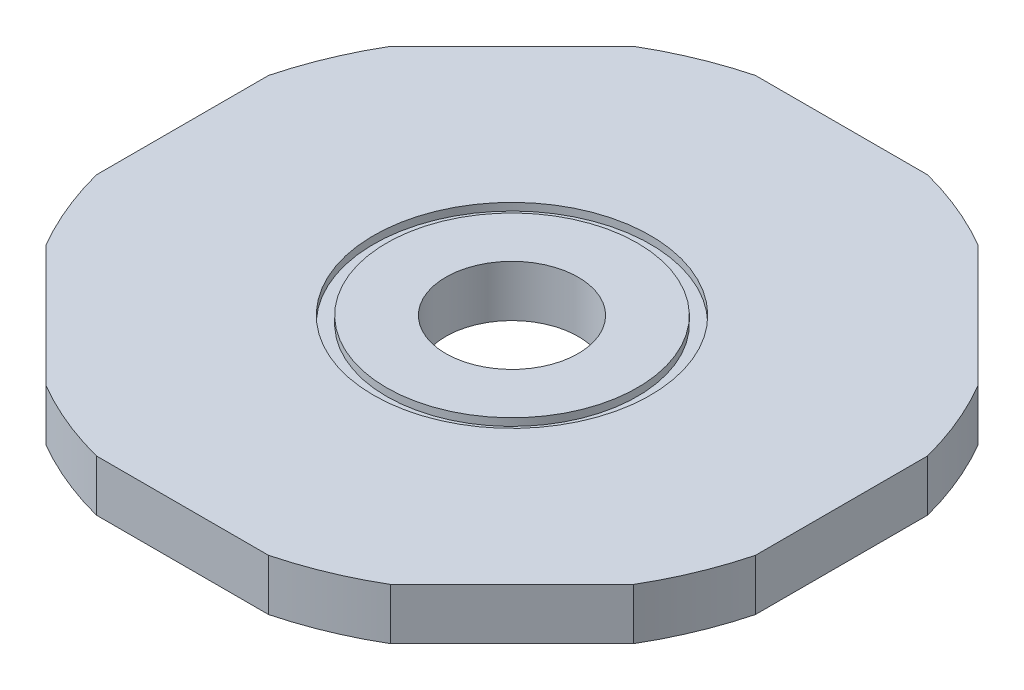
from build123d import *

# Parameters (mm, degrees)
BOSS_EXTRUDE1_DEPTH         = 19.05
SKETCH3_R                   = 24.5745
CUT_EXTRUDE1_DEPTH          = 175.004260005
SKETCH5_R                   = 51.3715
SKETCH5_R_2                 = 46.5455
CUT_EXTRUDE2_DEPTH          = 2.794
SKETCH7_R                   = 4
CUT_EXTRUDE3_DEPTH          = 12.7
M8_TAPPED_HOLE1_D           = 6.8
M8_TAPPED_HOLE1_DEPTH       = 13.957067295
M8_TAPPED_HOLE1_CSINK_D     = 8.05
M8_TAPPED_HOLE1_CSINK_ANGLE = 90
M8_TAPPED_HOLE1_TIP         = 2.042926105
CIRPATTERN1_COUNT           = 8


with BuildPart() as part:
    # Sketch1 → Boss-Extrude1 (new body)
    with BuildSketch(Plane(origin=(0, 0, 0), x_dir=(1, 0, 0), z_dir=(0, 1, 0))):
        with BuildLine():
            ThreePointArc((-31.932272077, 122.3), (-48.371185851, 116.778372909), (-63.899633215, 109.058685463))
            Line((-63.899633215, 109.058685463), (-109.058685463, 63.899633215))
            ThreePointArc((-109.058685463, 63.899633215), (-116.778372909, 48.371185851), (-122.3, 31.932272077))
            Line((-122.3, 31.932272077), (-122.3, -31.932272077))
            ThreePointArc((-122.3, -31.932272077), (-116.778372909, -48.371185851), (-109.058685463, -63.899633215))
            Line((-109.058685463, -63.899633215), (-63.899633215, -109.058685463))
            ThreePointArc((-63.899633215, -109.058685463), (-48.371185851, -116.778372909), (-31.932272077, -122.3))
            Line((-31.932272077, -122.3), (31.932272077, -122.3))
            ThreePointArc((31.932272077, -122.3), (48.371185851, -116.778372909), (63.899633215, -109.058685463))
            Line((63.899633215, -109.058685463), (109.058685463, -63.899633215))
            ThreePointArc((109.058685463, -63.899633215), (116.778372909, -48.371185851), (122.3, -31.932272077))
            Line((122.3, -31.932272077), (122.3, 31.932272077))
            ThreePointArc((122.3, 31.932272077), (116.778372909, 48.371185851), (109.058685463, 63.899633215))
            Line((109.058685463, 63.899633215), (63.899633215, 109.058685463))
            ThreePointArc((63.899633215, 109.058685463), (48.371185851, 116.778372909), (31.932272077, 122.3))
            Line((31.932272077, 122.3), (-31.932272077, 122.3))
        make_face()
    extrude(amount=BOSS_EXTRUDE1_DEPTH)

    # Sketch3 → Cut-Extrude1 (cut, through all)
    with BuildSketch(Plane(origin=(0, 19.05, 0), x_dir=(1, 0, 0), z_dir=(0, 1, 0))):
        with Locations(Location((0, 0, 0), (0, 0, 270))):
            Circle(SKETCH3_R)
    extrude(amount=-CUT_EXTRUDE1_DEPTH, mode=Mode.SUBTRACT)

    # Sketch5 → Cut-Extrude2 (cut)
    with BuildSketch(Plane(origin=(0, 19.05, 0), x_dir=(1, 0, 0), z_dir=(0, 1, 0))):
        with Locations(Location((0, 0, 0), (0, 0, 270))):
            Circle(SKETCH5_R)
        with Locations(Location((0, 0, 0), (0, 0, 270))):
            Circle(SKETCH5_R_2, mode=Mode.SUBTRACT)
    extrude(amount=-CUT_EXTRUDE2_DEPTH, mode=Mode.SUBTRACT)

    # Sketch7 → Cut-Extrude3 (cut)
    with BuildSketch(Plane.XZ):
        with Locations(Location((-71.374, 0, 0), (0, 0, 270))):
            Circle(SKETCH7_R)
    cut_extrude3 = extrude(amount=-CUT_EXTRUDE3_DEPTH, mode=Mode.SUBTRACT)

    # M8 Tapped Hole1
    with Locations(Plane(origin=(0, 0, 0), x_dir=(-1, 0, 0), z_dir=(0, -1, 0))):
        with Locations((-71.374, 0)):
            CounterSinkHole(M8_TAPPED_HOLE1_D / 2, M8_TAPPED_HOLE1_CSINK_D / 2, depth=M8_TAPPED_HOLE1_DEPTH, counter_sink_angle=M8_TAPPED_HOLE1_CSINK_ANGLE)
            with Locations((0, 0, -(M8_TAPPED_HOLE1_DEPTH + M8_TAPPED_HOLE1_TIP / 2))):  # 118° drill point
                Cone(0, M8_TAPPED_HOLE1_D / 2, M8_TAPPED_HOLE1_TIP, mode=Mode.SUBTRACT)

    # CirPattern1: Cut-Extrude3 ×8 about axis
    cirpattern1_axis = Axis((0, 0, 0), (0, 1, 0))
    for i in range(1, CIRPATTERN1_COUNT):
        add(cut_extrude3.rotate(cirpattern1_axis, i * 360 / CIRPATTERN1_COUNT), mode=Mode.SUBTRACT)


solid = part.part
